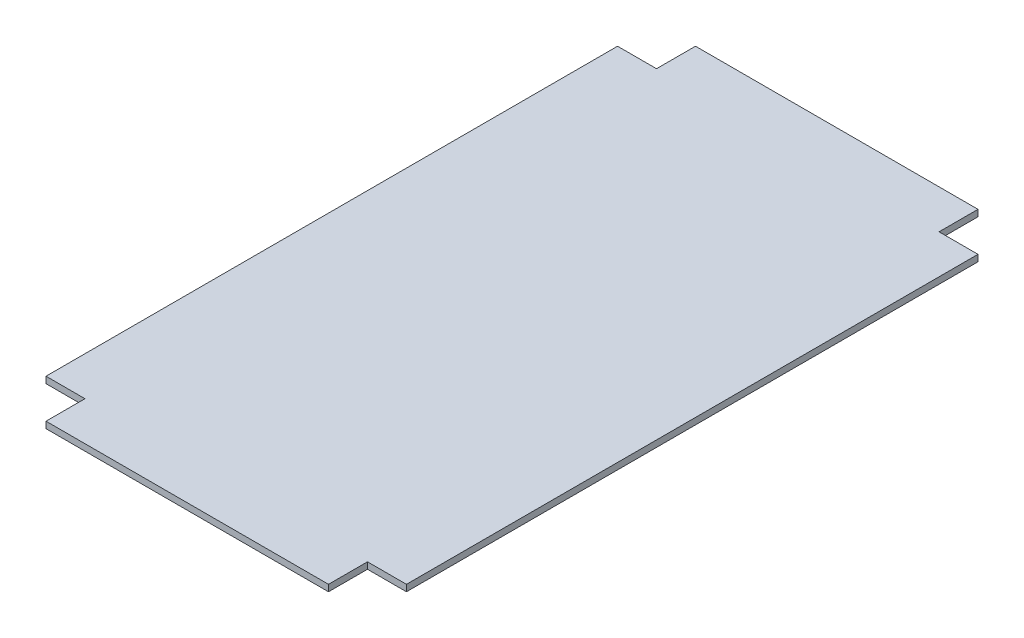
from build123d import *

# Parameters (mm, degrees)
SKETCH1_W           = 277.48
SKETCH1_H           = 440
BOSS_EXTRUDE1_DEPTH = 5
SKETCH2_W           = 217.48
SKETCH2_H           = 30
BOSS_EXTRUDE2_DEPTH = 5


with BuildPart() as part:
    # Sketch1 → Boss-Extrude1 (new body)
    with BuildSketch(Plane(origin=(0, 0, 0), x_dir=(1, 0, 0), z_dir=(0, 1, 0))):
        Rectangle(SKETCH1_W, SKETCH1_H)
    extrude(amount=BOSS_EXTRUDE1_DEPTH)

    # Sketch2 → Boss-Extrude2 (add)
    with BuildSketch(Plane(origin=(0, 5, 0), x_dir=(1, 0, 0), z_dir=(0, 1, 0))):
        with Locations((0, 235)):
            Rectangle(SKETCH2_W, SKETCH2_H)
        with Locations((0, -235)):
            Rectangle(SKETCH2_W, SKETCH2_H)
    extrude(amount=-BOSS_EXTRUDE2_DEPTH)


solid = part.part
